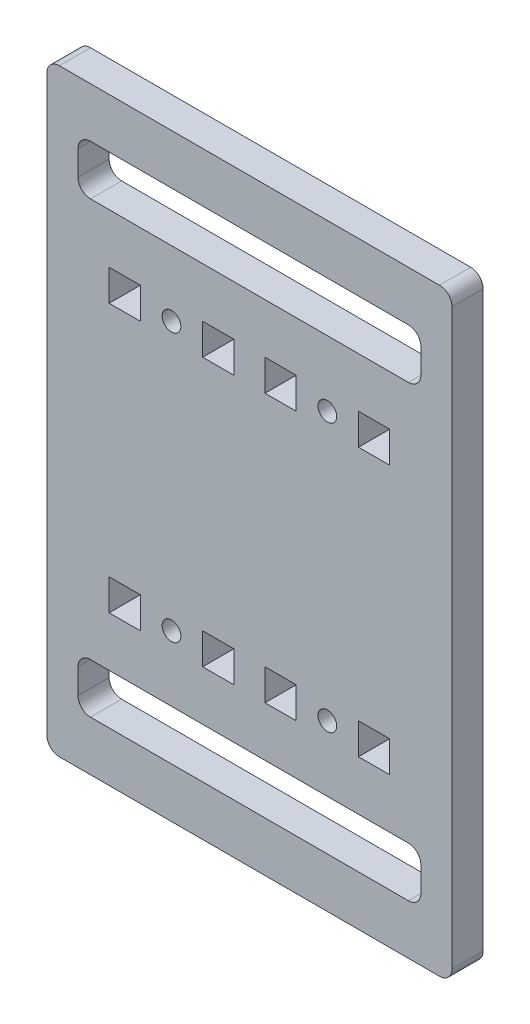
from build123d import *

# Parameters (mm, degrees)
ESQUISSE1_W        = 65
ESQUISSE1_H        = 96
ESQUISSE1_R        = 1.5
ESQUISSE1_W_2      = 55
ESQUISSE1_H_2      = 8
ESQUISSE1_W_3      = 5
ESQUISSE1_H_3      = 5
BOSS_EXTRU_1_DEPTH = 5
CONG_1_R           = 2


with BuildPart() as part:
    # Esquisse1 → Boss.-Extru.1 (new body)
    with BuildSketch(Plane.XY):
        with Locations((-12.5, 0)):
            Rectangle(ESQUISSE1_W, ESQUISSE1_H)
        with Locations((0, 21.5)):
            Circle(ESQUISSE1_R, mode=Mode.SUBTRACT)
        with Locations(Location((0, -21.5, 0), (0, 0, 90))):
            Circle(ESQUISSE1_R, mode=Mode.SUBTRACT)
        with Locations(Location((-25, 21.5, 0), (0, 0, 180))):
            Circle(ESQUISSE1_R, mode=Mode.SUBTRACT)
        with Locations((-25, -21.5)):
            Circle(ESQUISSE1_R, mode=Mode.SUBTRACT)
        with Locations((-12.5, -36)):
            Rectangle(ESQUISSE1_W_2, ESQUISSE1_H_2, mode=Mode.SUBTRACT)
        with Locations((-12.5, 36)):
            Rectangle(ESQUISSE1_W_2, ESQUISSE1_H_2, mode=Mode.SUBTRACT)
        with Locations((-7.5, 21.5)):
            Rectangle(ESQUISSE1_W_3, ESQUISSE1_H_3, mode=Mode.SUBTRACT)
        with Locations((7.5, 21.5)):
            Rectangle(ESQUISSE1_W_3, ESQUISSE1_H_3, mode=Mode.SUBTRACT)
        with Locations((-7.5, -21.5)):
            Rectangle(ESQUISSE1_W_3, ESQUISSE1_H_3, mode=Mode.SUBTRACT)
        with Locations((7.5, -21.5)):
            Rectangle(ESQUISSE1_W_3, ESQUISSE1_H_3, mode=Mode.SUBTRACT)
        with Locations((-17.5, 21.5)):
            Rectangle(ESQUISSE1_W_3, ESQUISSE1_H_3, mode=Mode.SUBTRACT)
        with Locations((-32.5, 21.5)):
            Rectangle(ESQUISSE1_W_3, ESQUISSE1_H_3, mode=Mode.SUBTRACT)
        with Locations((-17.5, -21.5)):
            Rectangle(ESQUISSE1_W_3, ESQUISSE1_H_3, mode=Mode.SUBTRACT)
        with Locations((-32.5, -21.5)):
            Rectangle(ESQUISSE1_W_3, ESQUISSE1_H_3, mode=Mode.SUBTRACT)
    extrude(amount=BOSS_EXTRU_1_DEPTH)

    # Congé1
    cong_1_edges = [part.edges().sort_by_distance(p)[0] for p in [
        (-40, 40, 2.5),
        (-40, 32, 2.5),
        (15, 32, 2.5),
        (15, 40, 2.5),
        (-40, -40, 2.5),
        (15, -40, 2.5),
        (15, -32, 2.5),
        (-40, -32, 2.5),
        (-45, -48, 2.5),
        (-45, 48, 2.5),
        (20, 48, 2.5),
        (20, -48, 2.5),
    ]]
    fillet(cong_1_edges, radius=CONG_1_R)


solid = part.part
